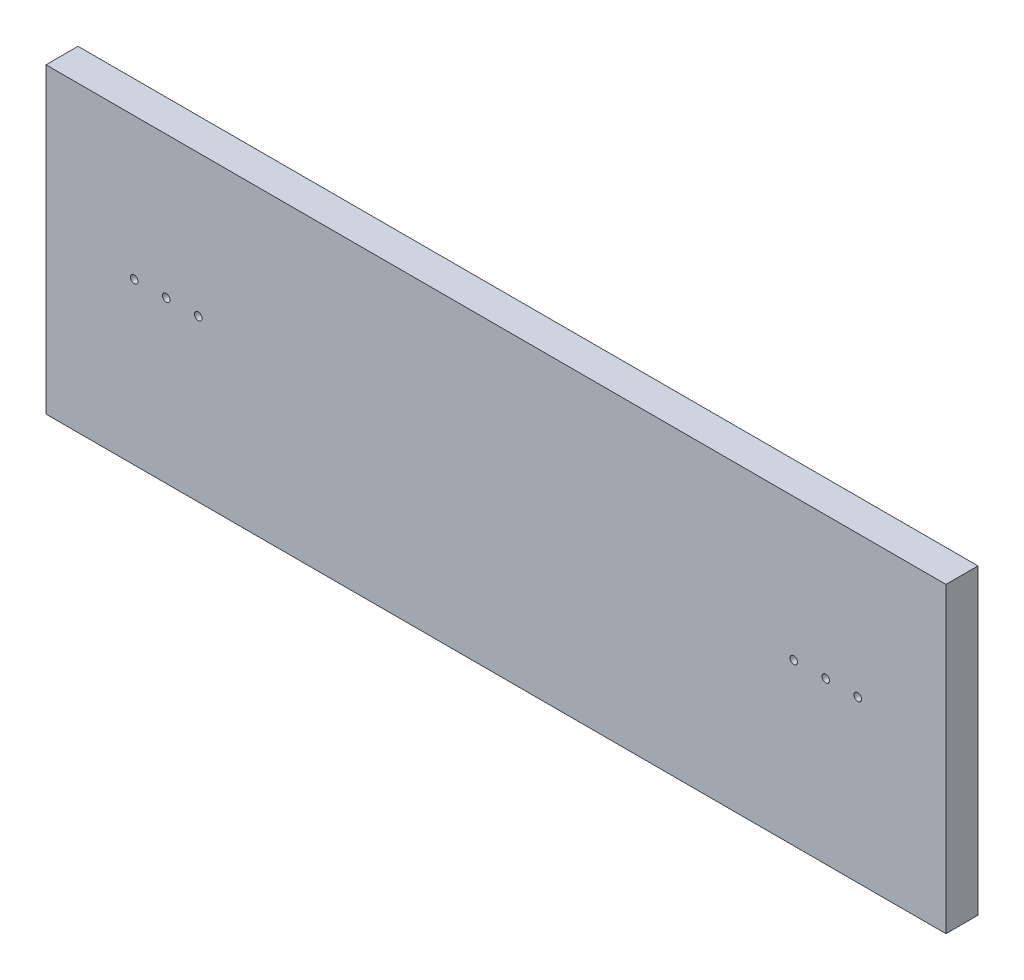
from build123d import *

# Parameters (mm, degrees)
SKETCH_1_W          = 357
SKETCH_1_H          = 120
EXTRUDE_1_DEPTH     = 12.7
SKETCH_2_R          = 1.5
CUT_EXTRUDE_1_DEPTH = 189.741993208


with BuildPart() as part:
    # 草图1 → 凸台-拉伸1 (new body)
    with BuildSketch(Plane.XY):
        Rectangle(SKETCH_1_W, SKETCH_1_H)
    extrude(amount=EXTRUDE_1_DEPTH)

    # 草图2 → 切除-拉伸1 (cut, through all)
    with BuildSketch(Plane.XY.offset(12.7)):
        with Locations((143.5, 3.8)):
            Circle(SKETCH_2_R)
        with Locations((130.8, 3.8)):
            Circle(SKETCH_2_R)
        with Locations((118.1, 3.8)):
            Circle(SKETCH_2_R)
        with Locations(Location((-118.1, 3.8, 0), (0, 0, 180))):
            Circle(SKETCH_2_R)
        with Locations(Location((-130.8, 3.8, 0), (0, 0, 180))):
            Circle(SKETCH_2_R)
        with Locations(Location((-143.5, 3.8, 0), (0, 0, 180))):
            Circle(SKETCH_2_R)
    extrude(amount=-CUT_EXTRUDE_1_DEPTH, mode=Mode.SUBTRACT)


solid = part.part
